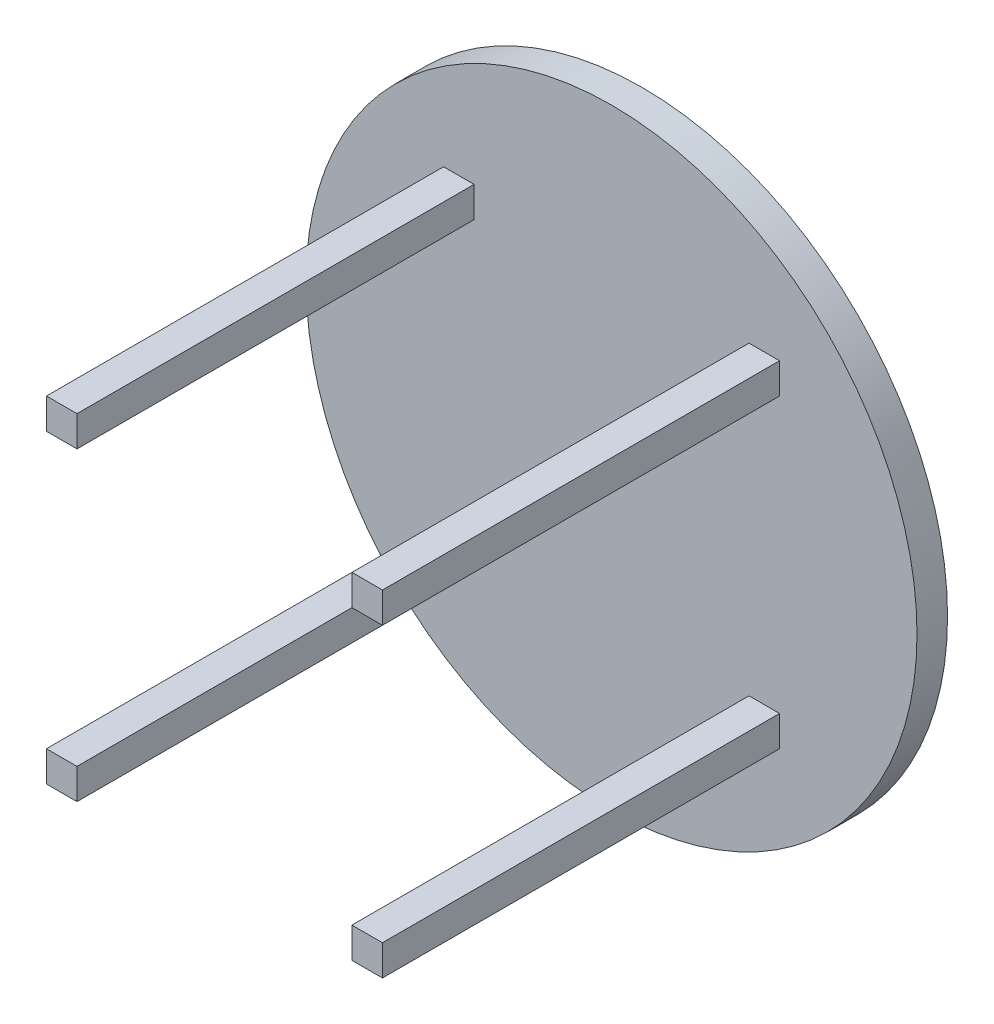
from build123d import *

# Parameters (mm, degrees)
SKETCH_1_R          = 500
EXTRUDE_1_DEPTH     = 50
SKETCH_2_W          = 50
SKETCH_2_H          = 50
EXTRUDE_2_DEPTH     = 700
SKETCH_3_W          = 50
SKETCH_3_H          = 50
EXTRUDE_3_DEPTH     = 700
SKETCH_4_W          = 50
SKETCH_4_H          = 50
EXTRUDE_4_DEPTH     = 700
SKETCH_5_W          = 50
SKETCH_5_H          = 50
EXTRUDE_5_DEPTH     = 700
SKETCH_6_W          = 200
SKETCH_6_H          = 100
EXTRUDE_6_DEPTH     = 50
SKETCH_7_W          = 150
SKETCH_7_H          = 50
CUT_EXTRUDE_1_DEPTH = 30


with BuildPart() as part:
    # 草图1 → 凸台-拉伸1 (new body)
    with BuildSketch(Plane.XY):
        Circle(SKETCH_1_R)
    extrude(amount=EXTRUDE_1_DEPTH)

    # 草图2 → 凸台-拉伸2 (add)
    with BuildSketch(Plane.XY):
        with Locations((250, 250)):
            Rectangle(SKETCH_2_W, SKETCH_2_H)
    extrude(amount=EXTRUDE_2_DEPTH)

    # 草图3 → 凸台-拉伸3 (add)
    with BuildSketch(Plane.XY):
        with Locations((-250, 250)):
            Rectangle(SKETCH_3_W, SKETCH_3_H)
    extrude(amount=EXTRUDE_3_DEPTH)

    # 草图4 → 凸台-拉伸4 (add)
    with BuildSketch(Plane.XY):
        with Locations((250, -250)):
            Rectangle(SKETCH_4_W, SKETCH_4_H)
    extrude(amount=EXTRUDE_4_DEPTH)

    # 草图5 → 凸台-拉伸5 (add)
    with BuildSketch(Plane.XY):
        with Locations((-250, -250)):
            Rectangle(SKETCH_5_W, SKETCH_5_H)
    extrude(amount=EXTRUDE_5_DEPTH)

    # 草图6 → 凸台-拉伸6 (add)
    with BuildSketch(Plane(origin=(0, 275, 0), x_dir=(1, 0, 0), z_dir=(0, 1, 0))):
        Rectangle(SKETCH_6_W, SKETCH_6_H)
    extrude(amount=EXTRUDE_6_DEPTH)

    # 草图7 → 切除-拉伸1 (cut)
    with BuildSketch(Plane(origin=(0, 275, 0), x_dir=(1, 0, 0), z_dir=(0, 1, 0))):
        Rectangle(SKETCH_7_W, SKETCH_7_H)
    extrude(amount=-CUT_EXTRUDE_1_DEPTH, mode=Mode.SUBTRACT)


solid = part.part
